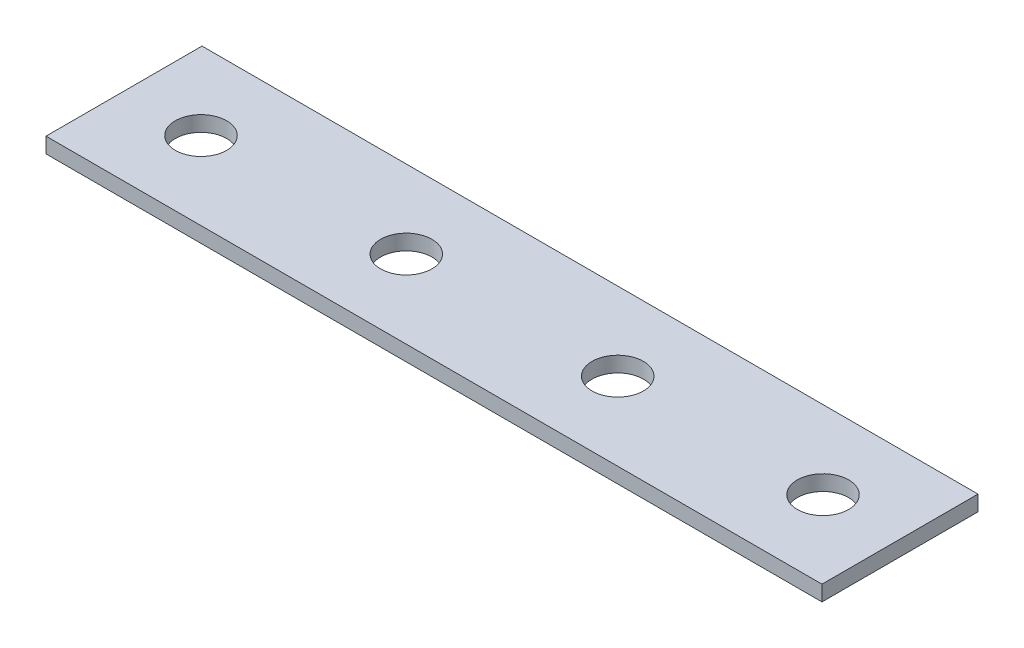
from build123d import *

# Parameters (mm, degrees)
SKETCH1_W      = 75.6
SKETCH1_H      = 15.2
SKETCH1_R      = 2.5
EXTRUDE1_DEPTH = 1.5


with BuildPart() as part:
    # Sketch1 → Extrude1 (new body)
    with BuildSketch(Plane(origin=(0, 0, 0), x_dir=(1, 0, 0), z_dir=(0, 1, 0))):
        Rectangle(SKETCH1_W, SKETCH1_H)
        with Locations((-30.3, 0)):
            Circle(SKETCH1_R, mode=Mode.SUBTRACT)
        with Locations((-10.3, 0)):
            Circle(SKETCH1_R, mode=Mode.SUBTRACT)
        with Locations((10.3, 0)):
            Circle(SKETCH1_R, mode=Mode.SUBTRACT)
        with Locations((30.3, 0)):
            Circle(SKETCH1_R, mode=Mode.SUBTRACT)
    extrude(amount=EXTRUDE1_DEPTH)


solid = part.part
